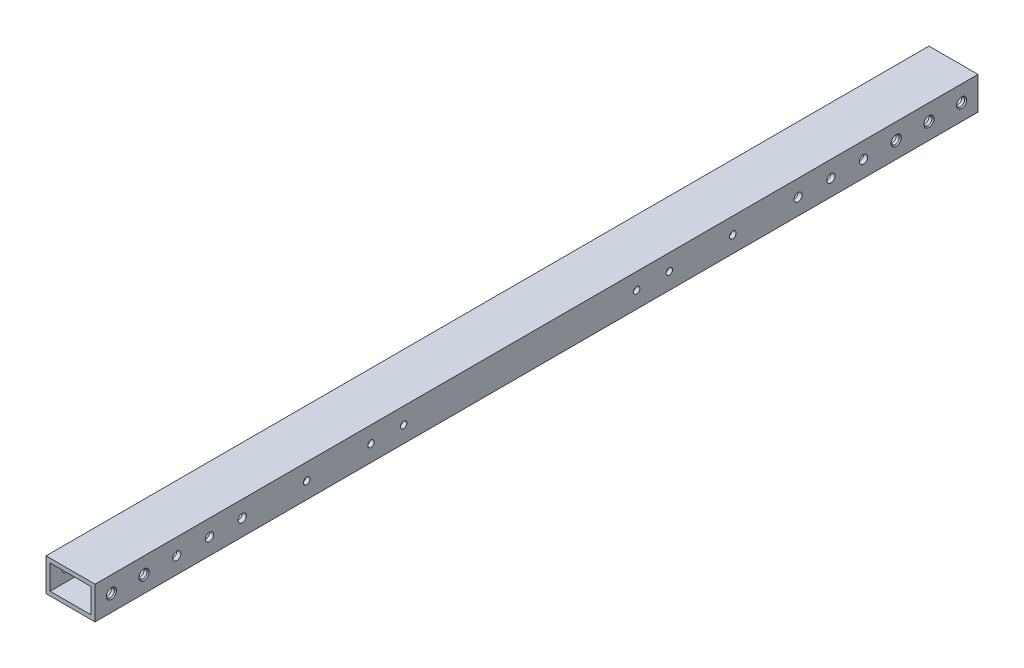
from build123d import *

# Parameters (mm, degrees)
BOSS_EXTRUDE1_DEPTH                  = 342.9
BOSS_EXTRUDE1_DEPTH_BACK             = 342.9
SKETCH3_W                            = 38.1
SKETCH3_H                            = 25.4
SKETCH3_W_2                          = 31.75
SKETCH3_H_2                          = 19.05
F_1_4_0_25_DIAMETER_HOLE2_AT_2_COUNT = 2
F_1_4_0_25_DIAMETER_HOLE2_AT_2_PITCH = 25.4
F_1_4_0_25_DIAMETER_HOLE2_AT_3_COUNT = 2
F_1_4_0_25_DIAMETER_HOLE2_AT_3_PITCH = 660.4
F_1_4_0_25_DIAMETER_HOLE2_AT_4_COUNT = 2
F_1_4_0_25_DIAMETER_HOLE2_AT_4_PITCH = 50.8
F_1_4_0_25_DIAMETER_HOLE2_AT_5_COUNT = 2
F_1_4_0_25_DIAMETER_HOLE2_AT_5_PITCH = 635
F_1_4_0_25_DIAMETER_HOLE3_D          = 6.35
F_13_64_0_20313_DIAMETER_HOLE1_D     = 5.159502
F_10_CLEARANCE_HOLE1_D               = 4.9784


with BuildPart() as part:
    # Sketch3 → Boss-Extrude1 (new, two sides: drawn at the far end of the back side and taken through both)
    with BuildSketch(Plane.XY.offset(-BOSS_EXTRUDE1_DEPTH_BACK)):
        Rectangle(SKETCH3_W, SKETCH3_H)
        Rectangle(SKETCH3_W_2, SKETCH3_H_2, mode=Mode.SUBTRACT)
    extrude(amount=BOSS_EXTRUDE1_DEPTH + BOSS_EXTRUDE1_DEPTH_BACK)

    # Sketch8 → 1/4 (0.25) Diameter Hole2 (revolve, cut)
    with BuildSketch(Plane(origin=(-19.05, 0, -330.2), x_dir=(0, 0, 1), z_dir=(0, 1, 0))):
        Polygon((0, 0), (0, 38.1), (3.9624, 38.1), (3.175, 37.194199916), (3.175, 0), align=None)
    f_1_4_0_25_diameter_hole2 = revolve(axis=Axis((-25.4, 0, -330.2), (1, 0, 0)), mode=Mode.SUBTRACT)

    # 1/4 (0.25) Diameter Hole2 at 2: 1/4 (0.25) Diameter Hole2 ×2
    with Locations(*[(0, 0, i * F_1_4_0_25_DIAMETER_HOLE2_AT_2_PITCH) for i in range(1, F_1_4_0_25_DIAMETER_HOLE2_AT_2_COUNT)]):
        add(f_1_4_0_25_diameter_hole2, mode=Mode.SUBTRACT)

    # 1/4 (0.25) Diameter Hole2 at 3: 1/4 (0.25) Diameter Hole2 ×2
    with Locations(*[(0, 0, i * F_1_4_0_25_DIAMETER_HOLE2_AT_3_PITCH) for i in range(1, F_1_4_0_25_DIAMETER_HOLE2_AT_3_COUNT)]):
        add(f_1_4_0_25_diameter_hole2, mode=Mode.SUBTRACT)

    # 1/4 (0.25) Diameter Hole2 at 4: 1/4 (0.25) Diameter Hole2 ×2
    with Locations(*[(0, 0, i * F_1_4_0_25_DIAMETER_HOLE2_AT_4_PITCH) for i in range(1, F_1_4_0_25_DIAMETER_HOLE2_AT_4_COUNT)]):
        add(f_1_4_0_25_diameter_hole2, mode=Mode.SUBTRACT)

    # 1/4 (0.25) Diameter Hole2 at 5: 1/4 (0.25) Diameter Hole2 ×2
    with Locations(*[(0, 0, i * F_1_4_0_25_DIAMETER_HOLE2_AT_5_PITCH) for i in range(1, F_1_4_0_25_DIAMETER_HOLE2_AT_5_COUNT)]):
        add(f_1_4_0_25_diameter_hole2, mode=Mode.SUBTRACT)

    # 1/4 (0.25) Diameter Hole3 (through all)
    with Locations(Plane(origin=(19.05, 0, 0), x_dir=(0, 0, -1), z_dir=(1, 0, 0))):
        with Locations((-279.4, 0), (-254, 0), (-228.6, 0), (254, 0), (228.6, 0), (203.2, 0)):
            Hole(F_1_4_0_25_DIAMETER_HOLE3_D / 2)

    # 13/64 (0.20313) Diameter Hole1 (through all)
    with Locations(Plane(origin=(19.05, 0, 0), x_dir=(0, 0, -1), z_dir=(1, 0, 0))):
        with Locations((152.4, 0), (-178.511799988, 0)):
            Hole(F_13_64_0_20313_DIAMETER_HOLE1_D / 2)

    # #10 Clearance Hole1 (through all)
    with Locations(Plane(origin=(19.05, 0, 0), x_dir=(0, 0, -1), z_dir=(1, 0, 0))):
        with Locations((-128.5875, 0), (-103.1875, 0), (77.7875, 0), (103.1875, 0)):
            Hole(F_10_CLEARANCE_HOLE1_D / 2)


solid = part.part
